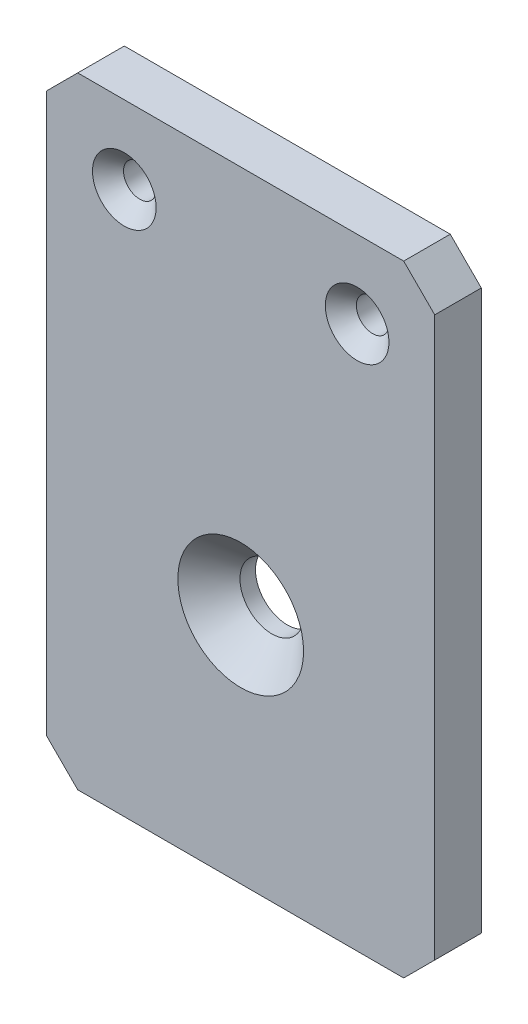
from build123d import *

# Parameters (mm, degrees)
SKETCH_1_W      = 50
SKETCH_1_H      = 80
SKETCH_1_R      = 4.1
SKETCH_1_R_2    = 2.1
EXTRUDE_1_DEPTH = 3
CHAMFER_2_SIZE  = 4
CHAMFER_3_SIZE  = 2


with BuildPart() as part:
    # 草图1 → 凸台-拉伸1 (new, symmetric)
    with BuildSketch(Plane.XY):
        with Locations((0, 10)):
            Rectangle(SKETCH_1_W, SKETCH_1_H)
        Circle(SKETCH_1_R, mode=Mode.SUBTRACT)
        with Locations((-15, 40)):
            Circle(SKETCH_1_R_2, mode=Mode.SUBTRACT)
        with Locations((15, 40)):
            Circle(SKETCH_1_R_2, mode=Mode.SUBTRACT)
    extrude(amount=EXTRUDE_1_DEPTH, both=True)

    # 倒角2
    chamfer_2_edges = [part.edges().sort_by_distance(p)[0] for p in [
        (-4.1, 0, 3),
        (-25, 50, 0),
        (25, 50, 0),
        (25, -30, 0),
        (-25, -30, 0),
    ]]
    chamfer(chamfer_2_edges, length=CHAMFER_2_SIZE)

    # 倒角3
    chamfer_3_edges = [part.edges().sort_by_distance(p)[0] for p in [
        (-17.1, 40, 3),
        (12.9, 40, 3),
    ]]
    chamfer(chamfer_3_edges, length=CHAMFER_3_SIZE)


solid = part.part
